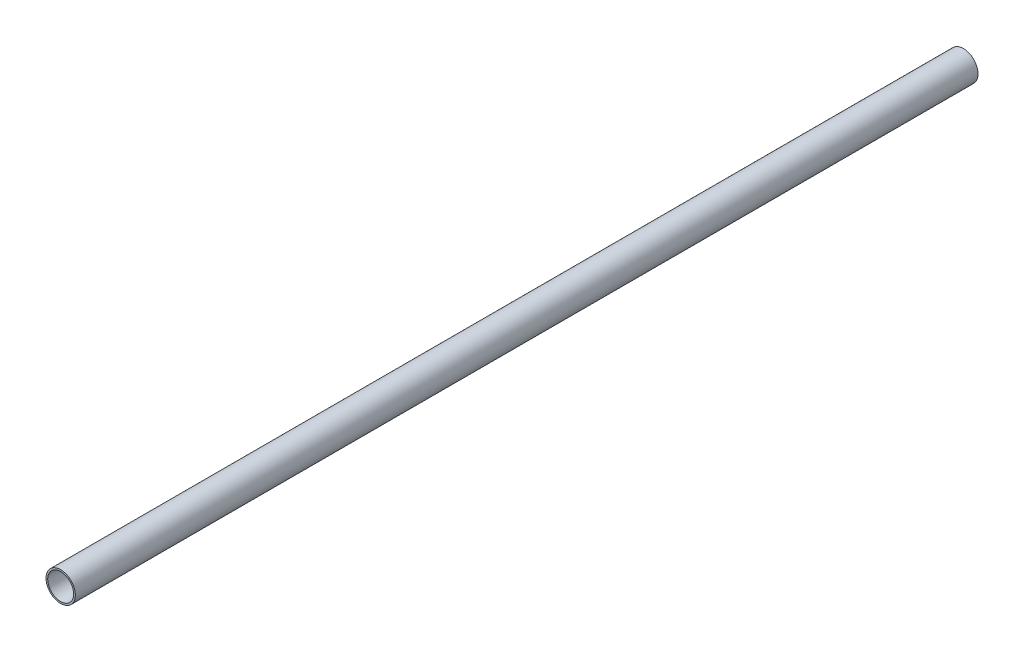
from build123d import *

# Parameters (mm, degrees)
SKETCH1_R           = 6.5
SKETCH1_R_2         = 5.75
BOSS_EXTRUDE1_DEPTH = 200.025


with BuildPart() as part:
    # Sketch1 → Boss-Extrude1 (new, symmetric)
    with BuildSketch(Plane.XY):
        with Locations(Location((0, 0, 0), (0, 0, 180))):
            Circle(SKETCH1_R)
        with Locations(Location((0, 0, 0), (0, 0, 180))):
            Circle(SKETCH1_R_2, mode=Mode.SUBTRACT)
    extrude(amount=BOSS_EXTRUDE1_DEPTH, both=True)


solid = part.part
